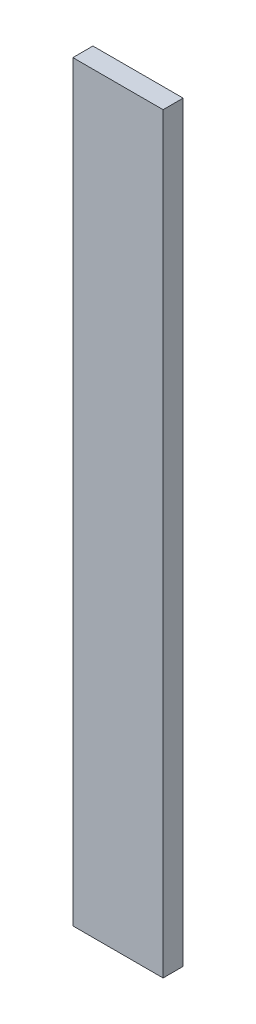
from build123d import *

# Parameters (mm, degrees)
SKETCH1_W           = 450
SKETCH1_H           = 3750
BOSS_EXTRUDE1_DEPTH = 100


with BuildPart() as part:
    # Sketch1 → Boss-Extrude1 (new body)
    with BuildSketch(Plane.XY):
        with Locations((225, -1875)):
            Rectangle(SKETCH1_W, SKETCH1_H)
    extrude(amount=BOSS_EXTRUDE1_DEPTH)


solid = part.part
